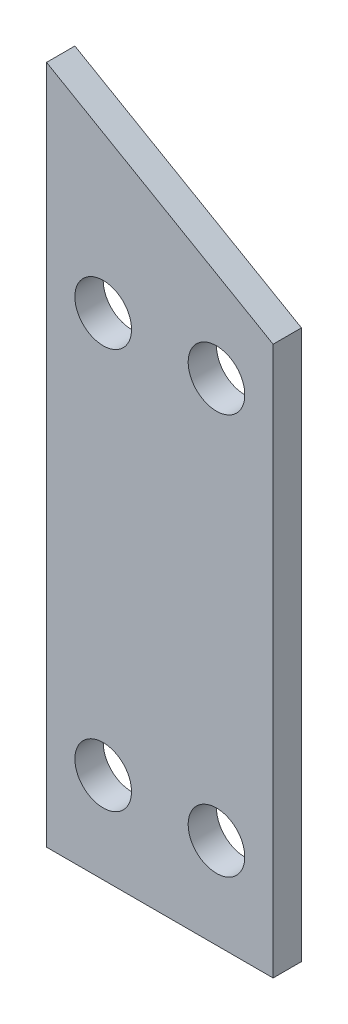
from build123d import *

# Parameters (mm, degrees)
SKETCH1_R           = 4.7625
BOSS_EXTRUDE1_DEPTH = 4.7625


with BuildPart() as part:
    # Sketch1 → Boss-Extrude1 (new body)
    with BuildSketch(Plane.XY):
        Polygon((0, 0), (-38.1, 0), (-38.1, 114.3), (0, 92.302954744), align=None)
        with Locations(Location((-28.575, 15.24, 0), (0, 0, 180))):
            Circle(SKETCH1_R, mode=Mode.SUBTRACT)
        with Locations(Location((-9.525, 15.24, 0), (0, 0, 180))):
            Circle(SKETCH1_R, mode=Mode.SUBTRACT)
        with Locations(Location((-28.575, 82.55, 0), (0, 0, 180))):
            Circle(SKETCH1_R, mode=Mode.SUBTRACT)
        with Locations(Location((-9.525, 82.55, 0), (0, 0, 180))):
            Circle(SKETCH1_R, mode=Mode.SUBTRACT)
    extrude(amount=BOSS_EXTRUDE1_DEPTH)


solid = part.part
